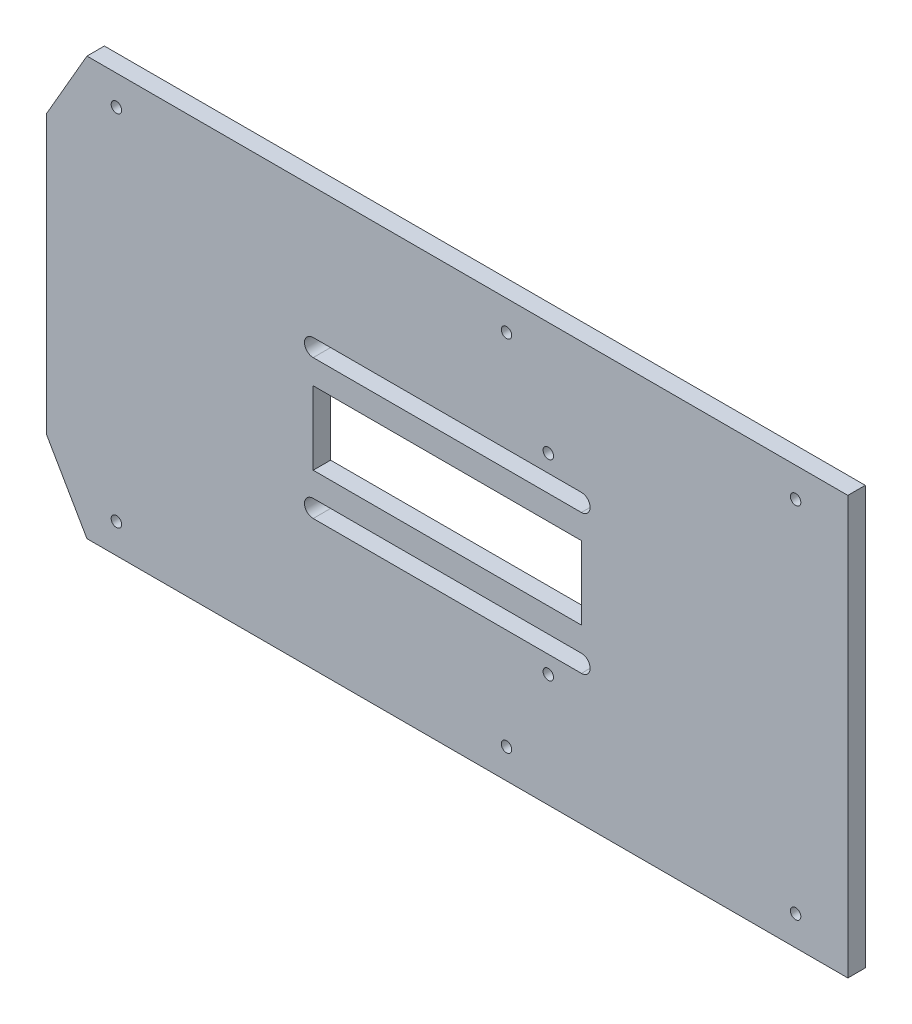
from build123d import *

# Parameters (mm, degrees)
BOSS_EXTRU_1_DEPTH      = 5
ENL_V_MAT_EXTRU_1_REACH = 131.808
ESQUISSE2_W             = 77
ESQUISSE2_H             = 21
ENL_V_MAT_EXTRU_2_REACH = 131.808
ESQUISSE4_R             = 1.5
ENL_V_MAT_EXTRU_3_DEPTH = 5


with BuildPart() as part:
    # Esquisse1 → Boss.-Extru.1 (new body)
    with BuildSketch(Plane.XY):
        Polygon((-115, 0), (115, 0), (115, 60), (-103.452994616, 60), (-115, 40), align=None)
    boss_extru_1 = extrude(amount=BOSS_EXTRU_1_DEPTH)

    # Symétrie1: Boss.-Extru.1 across Top Plane
    add(boss_extru_1.mirror(Plane(origin=(0, 0, 0), x_dir=(1, 0, 0), z_dir=(0, 1, 0))))

    # Esquisse2 → Enlèv. mat.-Extru.1 (cut, up to next)
    with BuildSketch(Plane.XY.offset(5), mode=Mode.PRIVATE) as enl_v_mat_extru_1_sk1:
        Rectangle(ESQUISSE2_W, ESQUISSE2_H)
    enl_v_mat_extru_1_tool1 = extrude(enl_v_mat_extru_1_sk1.sketch, amount=-ENL_V_MAT_EXTRU_1_REACH, mode=Mode.PRIVATE) & part.part
    add(enl_v_mat_extru_1_tool1.solids().sort_by_distance((0, 0, 5))[0], mode=Mode.SUBTRACT)

    # Esquisse3 → Enlèv. mat.-Extru.2 (cut, up to next)
    with BuildSketch(Plane.XY.offset(5), mode=Mode.PRIVATE) as enl_v_mat_extru_2_sk1:
        with BuildLine():
            Line((-38.5, 22.5), (38.5, 22.5))
            ThreePointArc((38.5, 22.5), (41, 20), (38.5, 17.5))
            Line((38.5, 17.5), (-38.5, 17.5))
            ThreePointArc((-38.5, 17.5), (-41, 20), (-38.5, 22.5))
        make_face()
    enl_v_mat_extru_2_tool1 = extrude(enl_v_mat_extru_2_sk1.sketch, amount=-ENL_V_MAT_EXTRU_2_REACH, mode=Mode.PRIVATE) & part.part
    enl_v_mat_extru_2 = enl_v_mat_extru_2_tool1.solids().sort_by_distance((0, 20, 5))[0]
    add(enl_v_mat_extru_2, mode=Mode.SUBTRACT)

    # Esquisse4 → Enlèv. mat.-Extru.3 (cut)
    with BuildSketch(Plane(origin=(0, 0, 0), x_dir=(-1, 0, 0), z_dir=(0, 0, -1))):
        with Locations((-100, 51.5)):
            Circle(ESQUISSE4_R)
        with Locations((-17, 51.5)):
            Circle(ESQUISSE4_R)
        with Locations((95, 51.5)):
            Circle(ESQUISSE4_R)
        with Locations((-29, 27.5)):
            Circle(ESQUISSE4_R)
    enl_v_mat_extru_3 = extrude(amount=-ENL_V_MAT_EXTRU_3_DEPTH, mode=Mode.SUBTRACT)

    # Symétrie2: Enlèv. mat.-Extru.3 across plane
    add(enl_v_mat_extru_3.mirror(Plane.ZX), mode=Mode.SUBTRACT)

    # Symétrie3: Enlèv. mat.-Extru.2 across plane
    add(enl_v_mat_extru_2.mirror(Plane.ZX), mode=Mode.SUBTRACT)


solid = part.part
